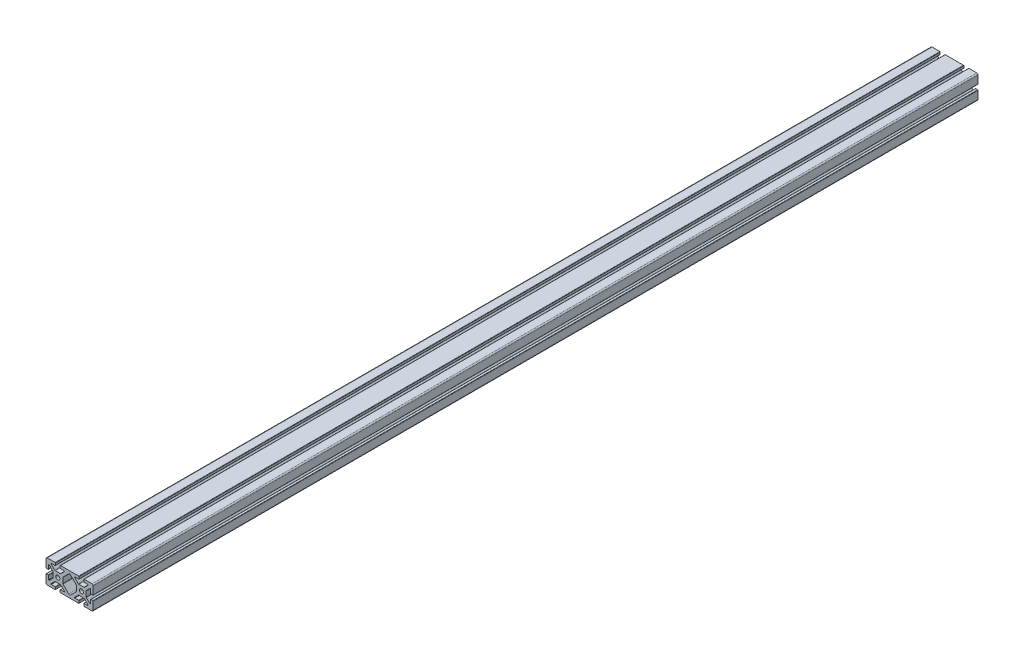
from build123d import *

# Parameters (mm, degrees)
SKETCH1_R           = 3.5
BOSS_EXTRUDE1_DEPTH = 750


with BuildPart() as part:
    # Sketch1 → Boss-Extrude1 (new, symmetric)
    with BuildSketch(Plane.XY):
        with BuildLine():
            Line((-30.9, 15.517871555), (-24.6, 15.517871555))
            ThreePointArc((-24.6, 15.517871555), (-24.175735931, 15.693607486), (-24, 16.117871555))
            Line((-24, 16.117871555), (-24, 19.4))
            ThreePointArc((-24, 19.4), (-24.175735931, 19.824264069), (-24.6, 20))
            Line((-24.6, 20), (-37.9, 20))
            ThreePointArc((-37.9, 20), (-39.38492424, 19.38492424), (-40, 17.9))
            Line((-40, 17.9), (-40, 4.6))
            ThreePointArc((-40, 4.6), (-39.824264069, 4.175735931), (-39.4, 4))
            Line((-39.4, 4), (-36.117871555, 4))
            ThreePointArc((-36.117871555, 4), (-35.693607486, 4.175735931), (-35.517871555, 4.6))
            Line((-35.517871555, 4.6), (-35.517871555, 10.9))
            ThreePointArc((-35.517871555, 10.9), (-35.147481614, 11.45432772), (-34.493607486, 11.324264069))
            Line((-34.493607486, 11.324264069), (-28.351471863, 5.182128445))
            ThreePointArc((-28.351471863, 5.182128445), (-28.091344561, 4.792820426), (-28, 4.333600308))
            Line((-28, 4.333600308), (-28, -4.333600308))
            ThreePointArc((-28, -4.333600308), (-28.091344561, -4.792820426), (-28.351471863, -5.182128445))
            Line((-28.351471863, -5.182128445), (-34.493607486, -11.324264069))
            ThreePointArc((-34.493607486, -11.324264069), (-35.147481614, -11.45432772), (-35.517871555, -10.9))
            Line((-35.517871555, -10.9), (-35.517871555, -4.6))
            ThreePointArc((-35.517871555, -4.6), (-35.693607486, -4.175735931), (-36.117871555, -4))
            Line((-36.117871555, -4), (-39.4, -4))
            ThreePointArc((-39.4, -4), (-39.824264069, -4.175735931), (-40, -4.6))
            Line((-40, -4.6), (-40, -17.9))
            ThreePointArc((-40, -17.9), (-39.38492424, -19.38492424), (-37.9, -20))
            Line((-37.9, -20), (-24.6, -20))
            ThreePointArc((-24.6, -20), (-24.175735931, -19.824264069), (-24, -19.4))
            Line((-24, -19.4), (-24, -16.117871555))
            ThreePointArc((-24, -16.117871555), (-24.175735931, -15.693607486), (-24.6, -15.517871555))
            Line((-24.6, -15.517871555), (-30.9, -15.517871555))
            ThreePointArc((-30.9, -15.517871555), (-31.45432772, -15.147481614), (-31.324264069, -14.493607486))
            Line((-31.324264069, -14.493607486), (-25.182128445, -8.351471863))
            ThreePointArc((-25.182128445, -8.351471863), (-24.792820426, -8.091344561), (-24.333600308, -8))
            Line((-24.333600308, -8), (-15.666399692, -8))
            ThreePointArc((-15.666399692, -8), (-15.207179574, -8.091344561), (-14.817871555, -8.351471863))
            Line((-14.817871555, -8.351471863), (-8.675735931, -14.493607486))
            ThreePointArc((-8.675735931, -14.493607486), (-8.54567228, -15.147481614), (-9.1, -15.517871555))
            Line((-9.1, -15.517871555), (-15.4, -15.517871555))
            ThreePointArc((-15.4, -15.517871555), (-15.824264069, -15.693607486), (-16, -16.117871555))
            Line((-16, -16.117871555), (-16, -19.4))
            ThreePointArc((-16, -19.4), (-15.824264069, -19.824264069), (-15.4, -20))
            Line((-15.4, -20), (15.4, -20))
            ThreePointArc((15.4, -20), (15.824264069, -19.824264069), (16, -19.4))
            Line((16, -19.4), (16, -16.117871555))
            ThreePointArc((16, -16.117871555), (15.824264069, -15.693607486), (15.4, -15.517871555))
            Line((15.4, -15.517871555), (9.1, -15.517871555))
            ThreePointArc((9.1, -15.517871555), (8.54567228, -15.147481614), (8.675735931, -14.493607486))
            Line((8.675735931, -14.493607486), (14.817871555, -8.351471863))
            ThreePointArc((14.817871555, -8.351471863), (15.207179574, -8.091344561), (15.666399692, -8))
            Line((15.666399692, -8), (24.333600308, -8))
            ThreePointArc((24.333600308, -8), (24.792820426, -8.091344561), (25.182128445, -8.351471863))
            Line((25.182128445, -8.351471863), (31.324264069, -14.493607486))
            ThreePointArc((31.324264069, -14.493607486), (31.45432772, -15.147481614), (30.9, -15.517871555))
            Line((30.9, -15.517871555), (24.6, -15.517871555))
            ThreePointArc((24.6, -15.517871555), (24.175735931, -15.693607486), (24, -16.117871555))
            Line((24, -16.117871555), (24, -19.4))
            ThreePointArc((24, -19.4), (24.175735931, -19.824264069), (24.6, -20))
            Line((24.6, -20), (37.9, -20))
            ThreePointArc((37.9, -20), (39.38492424, -19.38492424), (40, -17.9))
            Line((40, -17.9), (40, -4.6))
            ThreePointArc((40, -4.6), (39.824264069, -4.175735931), (39.4, -4))
            Line((39.4, -4), (36.117871555, -4))
            ThreePointArc((36.117871555, -4), (35.693607486, -4.175735931), (35.517871555, -4.6))
            Line((35.517871555, -4.6), (35.517871555, -10.9))
            ThreePointArc((35.517871555, -10.9), (35.147481614, -11.45432772), (34.493607486, -11.324264069))
            Line((34.493607486, -11.324264069), (28.351471863, -5.182128445))
            ThreePointArc((28.351471863, -5.182128445), (28.091344561, -4.792820426), (28, -4.333600308))
            Line((28, -4.333600308), (28, 4.333600308))
            ThreePointArc((28, 4.333600308), (28.091344561, 4.792820426), (28.351471863, 5.182128445))
            Line((28.351471863, 5.182128445), (34.493607486, 11.324264069))
            ThreePointArc((34.493607486, 11.324264069), (35.147481614, 11.45432772), (35.517871555, 10.9))
            Line((35.517871555, 10.9), (35.517871555, 4.6))
            ThreePointArc((35.517871555, 4.6), (35.693607486, 4.175735931), (36.117871555, 4))
            Line((36.117871555, 4), (39.4, 4))
            ThreePointArc((39.4, 4), (39.824264069, 4.175735931), (40, 4.6))
            Line((40, 4.6), (40, 17.9))
            ThreePointArc((40, 17.9), (39.38492424, 19.38492424), (37.9, 20))
            Line((37.9, 20), (24.6, 20))
            ThreePointArc((24.6, 20), (24.175735931, 19.824264069), (24, 19.4))
            Line((24, 19.4), (24, 16.117871555))
            ThreePointArc((24, 16.117871555), (24.175735931, 15.693607486), (24.6, 15.517871555))
            Line((24.6, 15.517871555), (30.9, 15.517871555))
            ThreePointArc((30.9, 15.517871555), (31.45432772, 15.147481614), (31.324264069, 14.493607486))
            Line((31.324264069, 14.493607486), (25.182128445, 8.351471863))
            ThreePointArc((25.182128445, 8.351471863), (24.792820426, 8.091344561), (24.333600308, 8))
            Line((24.333600308, 8), (15.666399692, 8))
            ThreePointArc((15.666399692, 8), (15.207179574, 8.091344561), (14.817871555, 8.351471863))
            Line((14.817871555, 8.351471863), (8.675735931, 14.493607486))
            ThreePointArc((8.675735931, 14.493607486), (8.54567228, 15.147481614), (9.1, 15.517871555))
            Line((9.1, 15.517871555), (15.4, 15.517871555))
            ThreePointArc((15.4, 15.517871555), (15.824264069, 15.693607486), (16, 16.117871555))
            Line((16, 16.117871555), (16, 19.4))
            ThreePointArc((16, 19.4), (15.824264069, 19.824264069), (15.4, 20))
            Line((15.4, 20), (-15.4, 20))
            ThreePointArc((-15.4, 20), (-15.824264069, 19.824264069), (-16, 19.4))
            Line((-16, 19.4), (-16, 16.117871555))
            ThreePointArc((-16, 16.117871555), (-15.824264069, 15.693607486), (-15.4, 15.517871555))
            Line((-15.4, 15.517871555), (-9.1, 15.517871555))
            ThreePointArc((-9.1, 15.517871555), (-8.54567228, 15.147481614), (-8.675735931, 14.493607486))
            Line((-8.675735931, 14.493607486), (-14.817871555, 8.351471863))
            ThreePointArc((-14.817871555, 8.351471863), (-15.207179574, 8.091344561), (-15.666399692, 8))
            Line((-15.666399692, 8), (-24.333600308, 8))
            ThreePointArc((-24.333600308, 8), (-24.792820426, 8.091344561), (-25.182128445, 8.351471863))
            Line((-25.182128445, 8.351471863), (-31.324264069, 14.493607486))
            ThreePointArc((-31.324264069, 14.493607486), (-31.45432772, 15.147481614), (-30.9, 15.517871555))
        make_face()
        with Locations((20, 0)):
            Circle(SKETCH1_R, mode=Mode.SUBTRACT)
        with Locations((-20, 0)):
            Circle(SKETCH1_R, mode=Mode.SUBTRACT)
        with BuildLine():
            Line((11.205591591, -5.182128445), (1.48492424, -14.902795796))
            ThreePointArc((1.48492424, -14.902795796), (0, -15.517871555), (-1.48492424, -14.902795796))
            Line((-1.48492424, -14.902795796), (-11.205591591, -5.182128445))
            ThreePointArc((-11.205591591, -5.182128445), (-11.465718893, -4.792820426), (-11.557063454, -4.333600308))
            Line((-11.557063454, -4.333600308), (-11.557063454, 4.333600308))
            ThreePointArc((-11.557063454, 4.333600308), (-11.465718893, 4.792820426), (-11.205591591, 5.182128445))
            Line((-11.205591591, 5.182128445), (-1.48492424, 14.902795796))
            ThreePointArc((-1.48492424, 14.902795796), (0, 15.517871555), (1.48492424, 14.902795796))
            Line((1.48492424, 14.902795796), (11.205591591, 5.182128445))
            ThreePointArc((11.205591591, 5.182128445), (11.465718893, 4.792820426), (11.557063454, 4.333600308))
            Line((11.557063454, 4.333600308), (11.557063454, -4.333600308))
            ThreePointArc((11.557063454, -4.333600308), (11.465718893, -4.792820426), (11.205591591, -5.182128445))
        make_face(mode=Mode.SUBTRACT)
    extrude(amount=BOSS_EXTRUDE1_DEPTH, both=True)


solid = part.part
